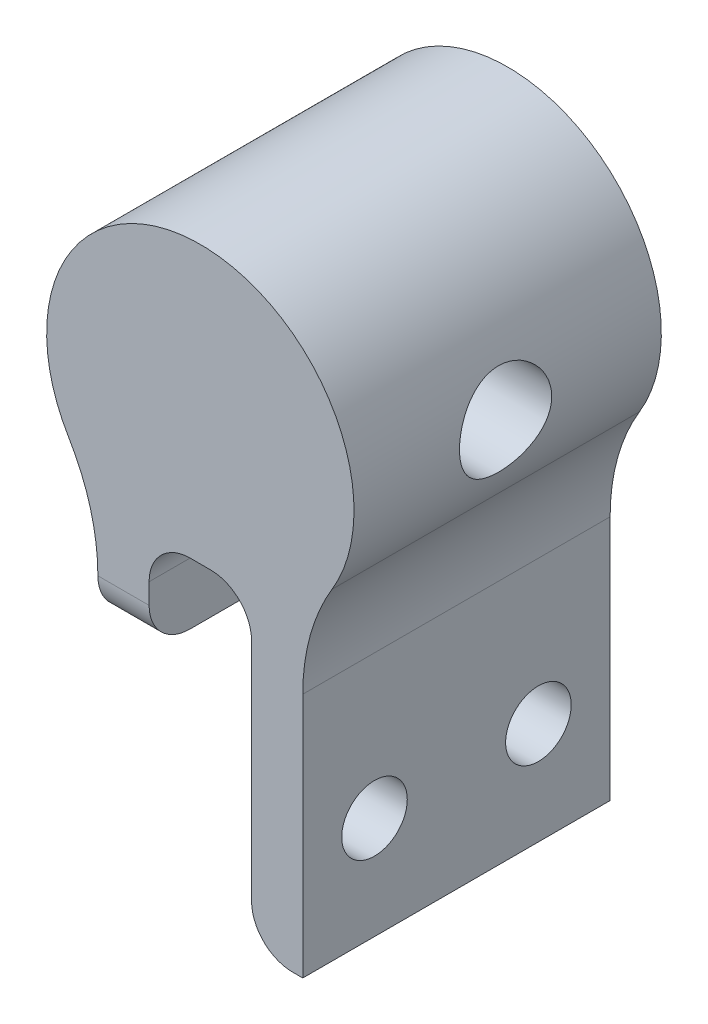
from build123d import *

# Parameters (mm, degrees)
BOSS_EXTRUDE1_DEPTH = 15
FILLET2_R           = 10
SKETCH8_R           = 1.6
CUT_EXTRUDE6_DEPTH  = 29.681007074
CUT_EXTRUDE7_REACH  = 30.681
SKETCH9_W           = 7.5
SKETCH9_H           = 10
CUT_EXTRUDE8_REACH  = 30.681
SKETCH10_R          = 1.6
FILLET3_R           = 2
FILLET6_R           = 2
SKETCH11_R          = 2.05
CUT_EXTRUDE9_DEPTH  = 10
SKETCH12_R          = 2.25
CUT_EXTRUDE10_DEPTH = 14.5


with BuildPart() as part:
    # Sketch2 → Boss-Extrude1 (new body)
    with BuildSketch(Plane.XY):
        with BuildLine():
            Line((-2.5, -6.008335649), (-2.5, -21.008335649))
            Line((-2.5, -21.008335649), (-5, -21.008335649))
            Line((-5, -21.008335649), (-5, -6.008335649))
            Line((-5, -6.008335649), (-5, -5.590169944))
            ThreePointArc((-5, -5.590169944), (0, 7.5), (5, -5.590169944))
            Line((5, -5.590169944), (5, -6.008335649))
            Line((5, -6.008335649), (5, -21.008335649))
            Line((5, -21.008335649), (2.5, -21.008335649))
            Line((2.5, -21.008335649), (2.5, -6.008335649))
            Line((2.5, -6.008335649), (-2.5, -6.008335649))
        make_face()
    extrude(amount=BOSS_EXTRUDE1_DEPTH)

    # Fillet2
    fillet2_edges = [part.edges().sort_by_distance(p)[0] for p in [
        (-5, -5.590169944, 7.5),
        (5, -5.590169944, 7.5),
    ]]
    fillet(fillet2_edges, radius=FILLET2_R)

    # Sketch8 → Cut-Extrude6 (cut, through all)
    with BuildSketch(Plane(origin=(5, 0, 0), x_dir=(0, 0, -1), z_dir=(1, 0, 0))):
        with Locations((-3.5, -16.008335649)):
            Circle(SKETCH8_R)
    extrude(amount=-CUT_EXTRUDE6_DEPTH, mode=Mode.SUBTRACT)

    # Sketch9 → Cut-Extrude7 (cut, up to next)
    with BuildSketch(Plane.ZY.offset(5), mode=Mode.PRIVATE) as cut_extrude7_sk1:
        with Locations((11.25, -16.008335649)):
            Rectangle(SKETCH9_W, SKETCH9_H)
    cut_extrude7_tool1 = extrude(cut_extrude7_sk1.sketch, amount=-CUT_EXTRUDE7_REACH, mode=Mode.PRIVATE) & part.part
    add(cut_extrude7_tool1.solids().sort_by_distance((-5, -16.008336, 11.25))[0], mode=Mode.SUBTRACT)

    # Sketch10 → Cut-Extrude8 (cut, up to next)
    with BuildSketch(Plane(origin=(5, 0, 0), x_dir=(0, 0, -1), z_dir=(1, 0, 0)), mode=Mode.PRIVATE) as cut_extrude8_sk1:
        with Locations((-11.5, -16.008335649)):
            Circle(SKETCH10_R)
    cut_extrude8_tool1 = extrude(cut_extrude8_sk1.sketch, amount=-CUT_EXTRUDE8_REACH, mode=Mode.PRIVATE) & part.part
    add(cut_extrude8_tool1.solids().sort_by_distance((5, -16.008336, 11.5))[0], mode=Mode.SUBTRACT)

    # Fillet3
    fillet3_edges = [part.edges().sort_by_distance(p)[0] for p in [
        (-2.5, -6.008335649, 7.5),
        (2.5, -21.008335649, 7.5),
        (2.5, -6.008335649, 7.5),
        (-2.5, -21.008335649, 3.75),
    ]]
    fillet(fillet3_edges, radius=FILLET3_R)

    # Fillet6
    fillet6_edges = [part.edges().sort_by_distance(p)[0] for p in [
        (-3.75, -11.008335649, 15),
        (-3.75, -11.008335649, 7.5),
    ]]
    fillet(fillet6_edges, radius=FILLET6_R)

    # Sketch11 → Cut-Extrude9 (cut)
    with BuildSketch(Plane(origin=(0, 0, 0), x_dir=(-1, 0, 0), z_dir=(0, 0, -1))):
        Circle(SKETCH11_R)
    extrude(amount=-CUT_EXTRUDE9_DEPTH, mode=Mode.SUBTRACT)

    # Sketch12 → Cut-Extrude10 (cut, symmetric)
    with BuildSketch(Plane(origin=(5, 0, 0), x_dir=(0, 0, -1), z_dir=(1, 0, 0))):
        with Locations((-7.6, 0)):
            Circle(SKETCH12_R)
    extrude(amount=CUT_EXTRUDE10_DEPTH, both=True, mode=Mode.SUBTRACT)


solid = part.part
